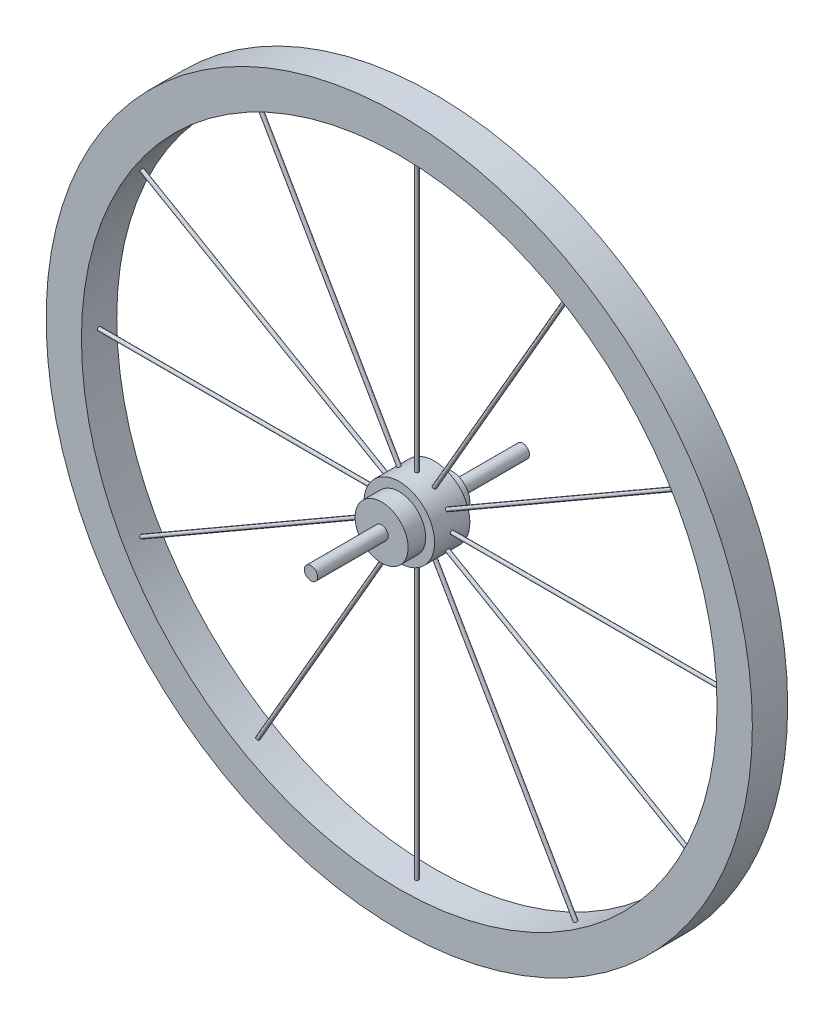
from build123d import *

# Parameters (mm, degrees)
BOSS_EXTRUDE1_DEPTH      = 12.7
BOSS_EXTRUDE1_DEPTH_BACK = 12.7
SKETCH1_R                = 25.4
SWEEP1_PROFILE_R         = 1.27
CIRPATTERN1_COUNT        = 12
BOSS_EXTRUDE2_DEPTH      = 12.7
BOSS_EXTRUDE2_DEPTH_BACK = 12.7
SKETCH43_R               = 254
SKETCH43_R_2             = 228.6
SKETCH44_R               = 19.05
BOSS_EXTRUDE3_DEPTH      = 12.7
SKETCH46_R               = 12.7
BOSS_EXTRUDE4_DEPTH      = 12.7
BOSS_EXTRUDE5_DEPTH      = 76.2
BOSS_EXTRUDE5_DEPTH_BACK = 76.2
SKETCH47_R               = 4.7625


with BuildPart() as part:
    # Sketch1 → Boss-Extrude1 (new, two sides: drawn at the far end of the back side and taken through both)
    with BuildSketch(Plane.XY.offset(-BOSS_EXTRUDE1_DEPTH_BACK)):
        Circle(SKETCH1_R)
    extrude(amount=BOSS_EXTRUDE1_DEPTH + BOSS_EXTRUDE1_DEPTH_BACK)

    # Sweep1: sweep along a path in Sketch2
    with BuildLine(Plane.XY) as sweep1_path:
        Line((0, 0), (228.6, 0))
    # Sweep1 profile (on start of the path) → Sweep1 (sweep)
    with BuildSketch(Plane(origin=(0, 0, 0), x_dir=(0, 0, 1), z_dir=(1, 0, 0))):
        Circle(SWEEP1_PROFILE_R)
    sweep1 = sweep(path=sweep1_path.line)

    # CirPattern1: Sweep1 ×12 about axis
    cirpattern1_axis = Axis((0, 0, 12.7), (0, 0, 1))
    for i in range(1, CIRPATTERN1_COUNT):
        add(sweep1.rotate(cirpattern1_axis, i * 360 / CIRPATTERN1_COUNT))

    # Sketch43 → Boss-Extrude2 (add, two sides: drawn at the far end of the back side and taken through both)
    with BuildSketch(Plane.XY.offset(-BOSS_EXTRUDE2_DEPTH_BACK)):
        Circle(SKETCH43_R)
        Circle(SKETCH43_R_2, mode=Mode.SUBTRACT)
    extrude(amount=BOSS_EXTRUDE2_DEPTH + BOSS_EXTRUDE2_DEPTH_BACK)

    # Sketch44 → Boss-Extrude3 (add)
    with BuildSketch(Plane.XY.offset(12.7)):
        Circle(SKETCH44_R)
    extrude(amount=BOSS_EXTRUDE3_DEPTH)

    # Sketch46 → Boss-Extrude4 (add)
    with BuildSketch(Plane(origin=(0, 0, -12.7), x_dir=(-1, 0, 0), z_dir=(0, 0, -1))):
        Circle(SKETCH46_R)
    extrude(amount=BOSS_EXTRUDE4_DEPTH)

    # Sketch47 → Boss-Extrude5 (add, two sides: drawn at the far end of the back side and taken through both)
    with BuildSketch(Plane.XY.offset(-BOSS_EXTRUDE5_DEPTH_BACK)):
        Circle(SKETCH47_R)
    extrude(amount=BOSS_EXTRUDE5_DEPTH + BOSS_EXTRUDE5_DEPTH_BACK)


solid = part.part
